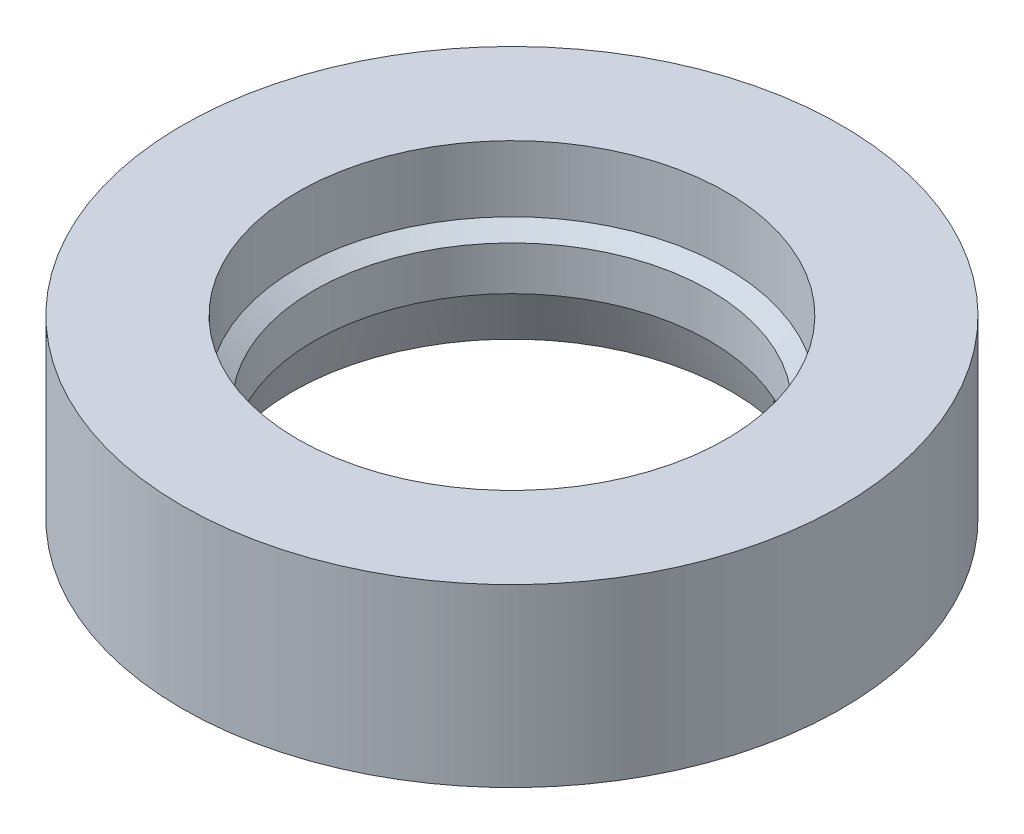
from build123d import *

# Parameters (mm, degrees)
CUT_EXTRUDE2_DEPTH      = 28.696934518
CUT_EXTRUDE2_DEPTH_BACK = 28.696934518
SKETCH10_R              = 0.75


with BuildPart() as part:
    # Sketch1 → Revolve1 (revolve)
    with BuildSketch(Plane(origin=(0, 0, 0), x_dir=(0, 0, -1), z_dir=(1, 0, 0))):
        Polygon((-6.059175667, 3.611199877), (-6.059175667, -4.388800123), (-4.559175656, -4.388756431), (-4.559175656, -2.888756431), (-3.059175668, -2.88856746), (-3.059175668, -4.388756431), (-1.059175668, -4.388756431), (-0.059175667, -1.888800123), (-0.059175667, 0.111199877), (-0.809175667, 0.611199877), (-0.809175667, 3.611199877), align=None)
    revolve(axis=Axis((0, 4.111199877, -8.940824333), (0, -1, 0)))

    # Sketch10 → Cut-Extrude2 (cut, two sides: drawn at the far end of the back side and taken through both)
    with BuildSketch(Plane(origin=(0, 5.926037439, -14.814834675), x_dir=(1, 0, 0), z_dir=(0, -0.37139627193644054, 0.9284744526327656)).offset(-CUT_EXTRUDE2_DEPTH_BACK)):
        with Locations(Location((4.041684761, -9.017, 0), (0, 0, 270))):
            Circle(SKETCH10_R)
    extrude(amount=CUT_EXTRUDE2_DEPTH + CUT_EXTRUDE2_DEPTH_BACK, mode=Mode.SUBTRACT)


solid = part.part
